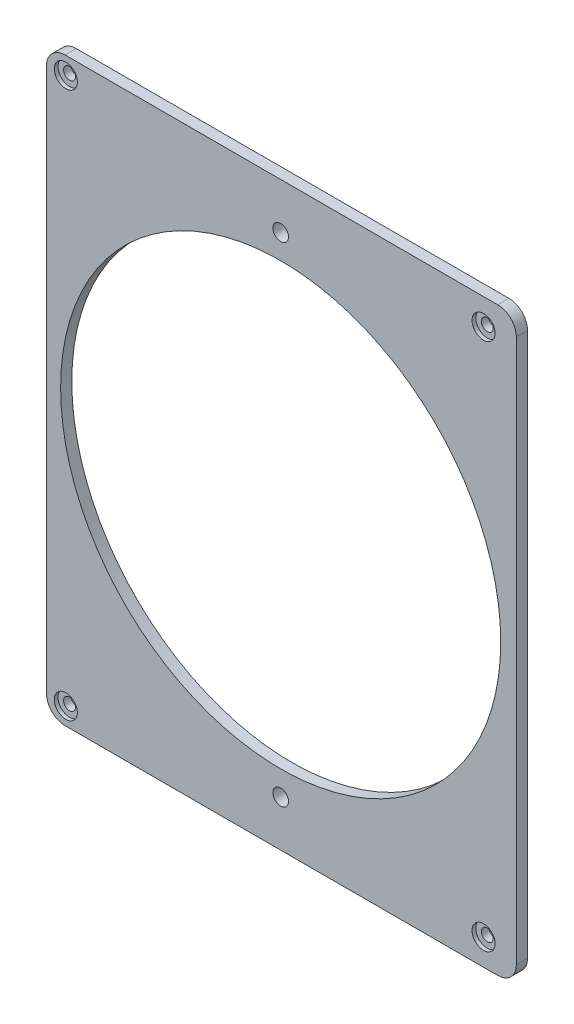
from build123d import *

# Parameters (mm, degrees)
SKETCH_1_R          = 59.1
SKETCH_1_R_2        = 1.6
EXTRUDE_1_DEPTH     = 3
SKETCH_2_R          = 2.1
CUT_EXTRUDE_1_DEPTH = 104.064494371
SKETCH_3_R          = 3.1
CUT_EXTRUDE_2_DEPTH = 1


with BuildPart() as part:
    # 草图1 → 凸台-拉伸1 (new body)
    with BuildSketch(Plane.XY):
        with BuildLine():
            Line((62.3, -78), (-53.9, -78))
            ThreePointArc((-53.9, -78), (-57.435533906, -76.535533906), (-58.9, -73))
            Line((-58.9, -73), (-58.9, 73))
            ThreePointArc((-58.9, 73), (-57.435533906, 76.535533906), (-53.9, 78))
            Line((-53.9, 78), (62.3, 78))
            ThreePointArc((62.3, 78), (65.835533906, 76.535533906), (67.3, 73))
            Line((67.3, 73), (67.3, -73))
            ThreePointArc((67.3, -73), (65.835533906, -76.535533906), (62.3, -78))
        make_face()
        with Locations((4, 0)):
            Circle(SKETCH_1_R, mode=Mode.SUBTRACT)
        with Locations((58.493442579, 70.964337058)):
            Circle(SKETCH_1_R_2, mode=Mode.SUBTRACT)
        with Locations((-53.705008218, 73.348219362)):
            Circle(SKETCH_1_R_2, mode=Mode.SUBTRACT)
        with Locations(Location((58.493442579, -70.964337058, 0), (0, 0, 180))):
            Circle(SKETCH_1_R_2, mode=Mode.SUBTRACT)
        with Locations(Location((-53.705008218, -73.348219362, 0), (0, 0, 180))):
            Circle(SKETCH_1_R_2, mode=Mode.SUBTRACT)
    extrude(amount=EXTRUDE_1_DEPTH)

    # 草图2 → 切除-拉伸1 (cut, through all)
    with BuildSketch(Plane.XY.offset(3)):
        with Locations((4, -65.65)):
            Circle(SKETCH_2_R)
        with Locations((4, 65.65)):
            Circle(SKETCH_2_R)
    extrude(amount=-CUT_EXTRUDE_1_DEPTH, mode=Mode.SUBTRACT)

    # 草图3 → 切除-拉伸2 (cut)
    with BuildSketch(Plane.XY.offset(3)):
        with Locations((58.493442579, -70.964337058)):
            Circle(SKETCH_3_R)
        with Locations((-53.705008218, -73.348219362)):
            Circle(SKETCH_3_R)
        with Locations(Location((-53.705008218, 73.348219362, 0), (0, 0, 180))):
            Circle(SKETCH_3_R)
        with Locations(Location((58.493442579, 70.964337058, 0), (0, 0, 180))):
            Circle(SKETCH_3_R)
    extrude(amount=-CUT_EXTRUDE_2_DEPTH, mode=Mode.SUBTRACT)


solid = part.part
